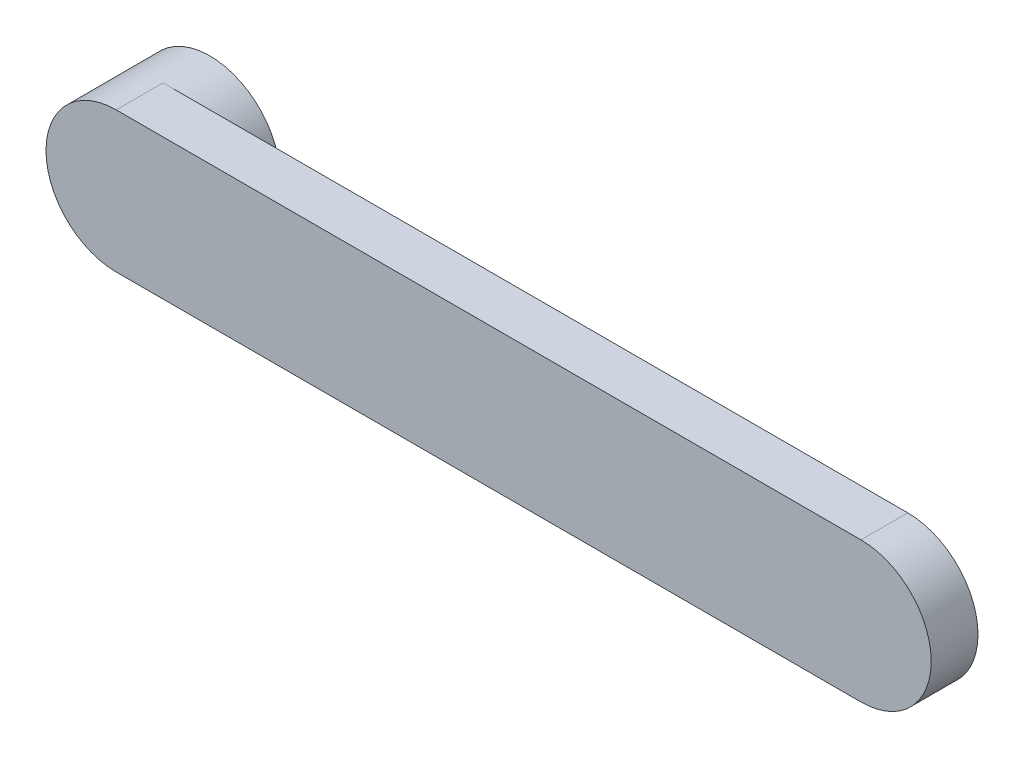
from build123d import *

# Parameters (mm, degrees)
EXTRUDE_1_DEPTH      = 10
EXTRUDE_1_DEPTH_BACK = 10
EXTRUDE_START        = -30
SKETCH_2_R           = 30
EXTRUDE_2_DEPTH      = 30


with BuildPart() as part:
    # 草图1 → 凸台-拉伸1 (new, two sides: drawn at the far end of the back side and taken through both)
    with BuildSketch(Plane.XY.offset(-EXTRUDE_1_DEPTH_BACK)):
        with BuildLine():
            Line((159.099025767, 30), (-159.099025767, 30))
            ThreePointArc((-159.099025767, 30), (-189.099025767, 0), (-159.099025767, -30))
            Line((-159.099025767, -30), (159.099025767, -30))
            ThreePointArc((159.099025767, -30), (189.099025767, 0), (159.099025767, 30))
        make_face()
    extrude(amount=EXTRUDE_1_DEPTH + EXTRUDE_1_DEPTH_BACK)

    # 草图2 → 凸台-拉伸2 (add)
    with BuildSketch(Plane.XY.offset(EXTRUDE_START)):
        with Locations((-159.099025767, 0)):
            Circle(SKETCH_2_R)
    extrude(amount=EXTRUDE_2_DEPTH)


solid = part.part
